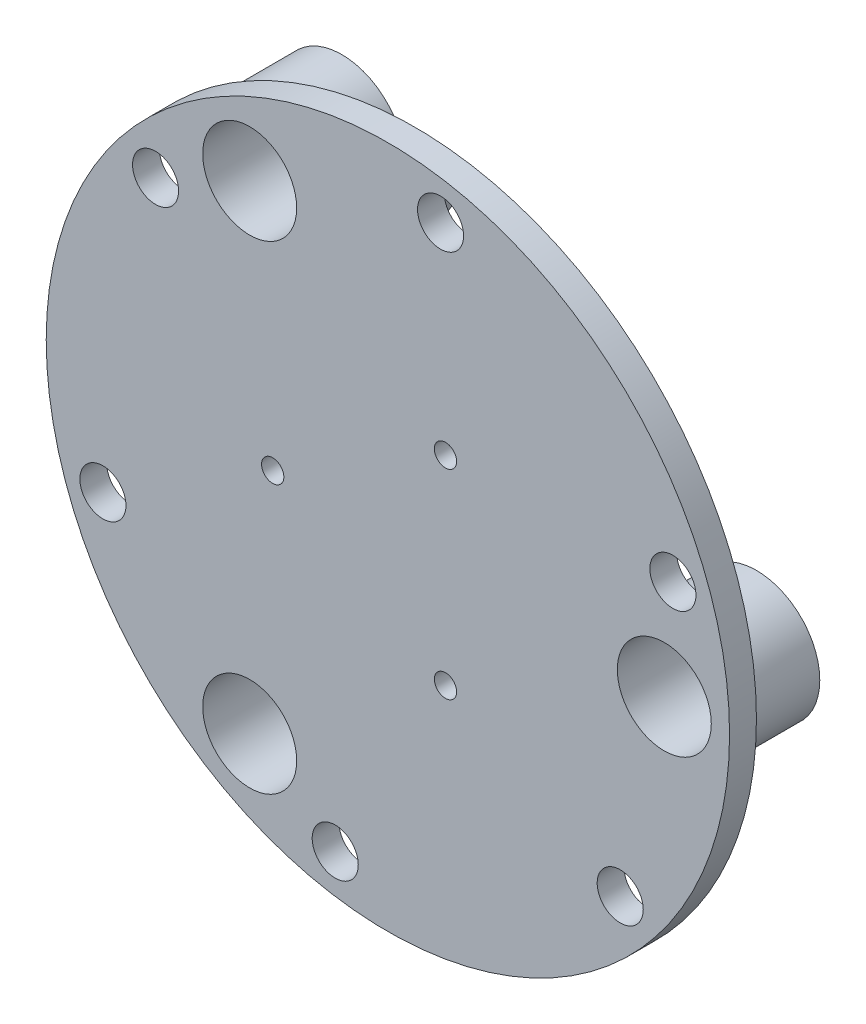
from build123d import *

# Parameters (mm, degrees)
F_01_START                                = 33.5
S01_JOINING_CENTRE_OF_FLOATING_Y_R        = 9
F_01_JOINING_CENTRE_OF_FLOATING_Y_DEPTH   = 3.5
F_02_START                                = 33.5
F_02_FLOATING_SPOKE_1_DEPTH               = 3.5
F_03_START                                = 33.5
F_03_FLOATING_SPOKE_2_DEPTH               = 3.5
F_04_START                                = 33.5
F_04_FLOATING_SPOKE_3_DEPTH               = 3.5
F_05_START                                = 33.5
F_05_MOVING_TENDON_TIE_WEB_1_DEPTH        = 3.5
F_06_START                                = 29.8
S06_TENDON_ANCHOR_BASE_1_R                = 4.2
F_06_TENDON_ANCHOR_BASE_1_DEPTH           = 3.7
F_07_START                                = 28
S07_TENDON_MOUTH_1_R                      = 3.15
F_07_TENDON_MOUTH_1_DEPTH                 = 1.8
F_08_START                                = 33.5
F_08_MOVING_TENDON_TIE_WEB_2_DEPTH        = 3.5
F_09_START                                = 29.8
S09_TENDON_ANCHOR_BASE_2_R                = 4.2
F_09_TENDON_ANCHOR_BASE_2_DEPTH           = 3.7
F_10_START                                = 28
S10_TENDON_MOUTH_2_R                      = 3.15
F_10_TENDON_MOUTH_2_DEPTH                 = 1.8
F_11_START                                = 33.5
F_11_MOVING_TENDON_TIE_WEB_3_DEPTH        = 3.5
F_12_START                                = 29.8
S12_TENDON_ANCHOR_BASE_3_R                = 4.2
F_12_TENDON_ANCHOR_BASE_3_DEPTH           = 3.7
F_13_START                                = 28
S13_TENDON_MOUTH_3_R                      = 3.15
F_13_TENDON_MOUTH_3_DEPTH                 = 1.8
F_14_START                                = 33.5
S14_JOINED_DRIVE_HOOP_R                   = 44.5
F_14_JOINED_DRIVE_HOOP_DEPTH              = 3.5
F_15_START                                = 25
S15_SLIDING_GUIDE_BARREL_1_R              = 8.25
F_15_SLIDING_GUIDE_BARREL_1_DEPTH         = 12
F_16_START                                = 25
S16_SLIDING_GUIDE_BARREL_2_R              = 8.25
F_16_SLIDING_GUIDE_BARREL_2_DEPTH         = 12
F_17_START                                = 25
S17_SLIDING_GUIDE_BARREL_3_R              = 8.25
F_17_SLIDING_GUIDE_BARREL_3_DEPTH         = 12
F_18_START                                = 24
S18_GUIDE_BUSHING_SEATS_R                 = 6.12
F_18_GUIDE_BUSHING_SEATS_DEPTH            = 14
F_19_START                                = 27.8
S19_THROUGH_TENDON_TIE_EYES_R             = 1.45
F_19_THROUGH_TENDON_TIE_EYES_DEPTH        = 10
F_20_START                                = -7.2
F_20_INTEGRAL_B1_FORK_CHEEK_L_DEPTH       = 3.6
F_21_START                                = 3.6
F_21_INTEGRAL_B1_FORK_CHEEK_R_DEPTH       = 3.6
F_22_START                                = -7.5
S22_B1_PIVOT_THROUGH_BOTH_CHEEKS_R        = 1.65
F_22_B1_PIVOT_THROUGH_BOTH_CHEEKS_DEPTH   = 15
F_23_START                                = -7.3
S23_B1_RECESSED_PIVOT_SCREW_HEAD_R        = 2.7
F_23_B1_RECESSED_PIVOT_SCREW_HEAD_DEPTH   = 1.5
F_24_START                                = -7.2
F_24_INTEGRAL_B2_FORK_CHEEK_L_DEPTH       = 3.6
F_25_START                                = 3.6
F_25_INTEGRAL_B2_FORK_CHEEK_R_DEPTH       = 3.6
F_26_START                                = 7.5
S26_B2_PIVOT_THROUGH_BOTH_CHEEKS_R        = 2.6
F_26_B2_PIVOT_THROUGH_BOTH_CHEEKS_DEPTH   = 15
F_27_START                                = -7.3
S27_B2_RECESSED_PIVOT_SCREW_HEAD_R        = 2.7
F_27_B2_RECESSED_PIVOT_SCREW_HEAD_DEPTH   = 1.5
F_28_START                                = -7.2
F_28_INTEGRAL_B3_FORK_CHEEK_L_DEPTH       = 3.6
F_29_START                                = 3.6
F_29_INTEGRAL_B3_FORK_CHEEK_R_DEPTH       = 3.6
F_30_START                                = 7.5
S30_B3_PIVOT_THROUGH_BOTH_CHEEKS_R        = 2.6
F_30_B3_PIVOT_THROUGH_BOTH_CHEEKS_DEPTH   = 15
F_31_START                                = -7.3
S31_B3_RECESSED_PIVOT_SCREW_HEAD_R        = 2.7
F_31_B3_RECESSED_PIVOT_SCREW_HEAD_DEPTH   = 1.5
CUT_EXTRUDE1_DEPTH                        = 74.425869509
CUT_EXTRUDE1_DEPTH_BACK                   = 16
SKETCH1_R                                 = 2.6
FORK_INNER_FACES_8_40_MM_LUG_CLEARANCE_BY = 0.6
FORK_INNER_FACES_8_40_MM_LUG_CLEAR_2_BY   = 0.6
FORK_INNER_FACES_8_40_MM_LUG_CLEAR_3_BY   = 0.6
FORK_INNER_FACES_8_40_MM_LUG_CLEAR_4_BY   = 0.6
FORK_INNER_FACES_8_40_MM_LUG_CLEAR_5_BY   = 0.6
FORK_INNER_FACES_8_40_MM_LUG_CLEAR_6_BY   = 0.6
SIX_START                                 = 37.1
SIX_6_MM_HOLES_ON_79_MM_PITCH_CIRCLE_R    = 3
SIX_LIGHTENING_HOLES_AT_60_DEGREES_DEPTH  = 3.7
CENTRAL_START                             = 30.55
CENTRAL_SIX_SIDED_RIB_JUNCTION_DEPTH      = 3


with BuildPart() as part:
    # S01 - Joining centre of floating Y → 01 - Joining centre of floating Y (new body)
    with BuildSketch(Plane.XY.offset(F_01_START)):
        Circle(S01_JOINING_CENTRE_OF_FLOATING_Y_R)
    extrude(amount=F_01_JOINING_CENTRE_OF_FLOATING_Y_DEPTH)

    # S02 - Floating spoke 1 → 02 - Floating spoke 1 (add)
    with BuildSketch(Plane.XY.offset(F_02_START)):
        with BuildLine():
            Line((4.65, -8.054036255), (-21.330762114, -23.054036255))
            ThreePointArc((-21.330762114, -23.054036255), (-34.034798369, -19.65), (-30.630762114, -6.945963745))
            Line((-30.630762114, -6.945963745), (-4.65, 8.054036255))
            ThreePointArc((-4.65, 8.054036255), (8.054036255, 4.65), (4.65, -8.054036255))
        make_face()
    extrude(amount=F_02_FLOATING_SPOKE_1_DEPTH)

    # S03 - Floating spoke 2 → 03 - Floating spoke 2 (add)
    with BuildSketch(Plane.XY.offset(F_03_START)):
        with BuildLine():
            Line((4.65, 8.054036255), (30.630762114, -6.945963745))
            ThreePointArc((30.630762114, -6.945963745), (34.034798369, -19.65), (21.330762114, -23.054036255))
            Line((21.330762114, -23.054036255), (-4.65, -8.054036255))
            ThreePointArc((-4.65, -8.054036255), (-8.054036255, 4.65), (4.65, 8.054036255))
        make_face()
    extrude(amount=F_03_FLOATING_SPOKE_2_DEPTH)

    # S04 - Floating spoke 3 → 04 - Floating spoke 3 (add)
    with BuildSketch(Plane.XY.offset(F_04_START)):
        with BuildLine():
            Line((-9.3, 0), (-9.3, 30))
            ThreePointArc((-9.3, 30), (0, 39.3), (9.3, 30))
            Line((9.3, 30), (9.3, 0))
            ThreePointArc((9.3, 0), (0, -9.3), (-9.3, 0))
        make_face()
    extrude(amount=F_04_FLOATING_SPOKE_3_DEPTH)

    # S05 - Moving tendon tie web 1 → 05 - Moving tendon tie web 1 (add)
    with BuildSketch(Plane.XY.offset(F_05_START)):
        with BuildLine():
            Line((25.299707774, -21.263079513), (6.818945661, -19.25346057))
            ThreePointArc((6.818945661, -19.25346057), (1.236920487, -12.309326717), (8.181054339, -6.727301544))
            Line((8.181054339, -6.727301544), (26.661816453, -8.736920487))
            ThreePointArc((26.661816453, -8.736920487), (32.243841627, -15.681054339), (25.299707774, -21.263079513))
        make_face()
    extrude(amount=F_05_MOVING_TENDON_TIE_WEB_1_DEPTH)

    # S06 - Tendon anchor base 1 → 06 - Tendon anchor base 1 (add)
    with BuildSketch(Plane.XY.offset(F_06_START)):
        with Locations((7.5, -12.990381057)):
            Circle(S06_TENDON_ANCHOR_BASE_1_R)
    extrude(amount=F_06_TENDON_ANCHOR_BASE_1_DEPTH)

    # S07 - Tendon mouth 1 → 07 - Tendon mouth 1 (add)
    with BuildSketch(Plane.XY.offset(F_07_START)):
        with Locations((7.5, -12.990381057)):
            Circle(S07_TENDON_MOUTH_1_R)
    extrude(amount=F_07_TENDON_MOUTH_1_DEPTH)

    # S08 - Moving tendon tie web 2 → 08 - Moving tendon tie web 2 (add)
    with BuildSketch(Plane.XY.offset(F_08_START)):
        with BuildLine():
            Line((5.764513134, 32.541729397), (13.264513134, 15.532110454))
            ThreePointArc((13.264513134, 15.532110454), (10.041729397, 7.225867923), (1.735486866, 10.448651659))
            Line((1.735486866, 10.448651659), (-5.764513134, 27.458270603))
            ThreePointArc((-5.764513134, 27.458270603), (-2.541729397, 35.764513134), (5.764513134, 32.541729397))
        make_face()
    extrude(amount=F_08_MOVING_TENDON_TIE_WEB_2_DEPTH)

    # S09 - Tendon anchor base 2 → 09 - Tendon anchor base 2 (add)
    with BuildSketch(Plane.XY.offset(F_09_START)):
        with Locations((7.5, 12.990381057)):
            Circle(S09_TENDON_ANCHOR_BASE_2_R)
    extrude(amount=F_09_TENDON_ANCHOR_BASE_2_DEPTH)

    # S10 - Tendon mouth 2 → 10 - Tendon mouth 2 (add)
    with BuildSketch(Plane.XY.offset(F_10_START)):
        with Locations((7.5, 12.990381057)):
            Circle(S10_TENDON_MOUTH_2_R)
    extrude(amount=F_10_TENDON_MOUTH_2_DEPTH)

    # S11 - Moving tendon tie web 3 → 11 - Moving tendon tie web 3 (add)
    with BuildSketch(Plane.XY.offset(F_11_START)):
        with BuildLine():
            Line((-31.064220908, -11.278649884), (-20.083458795, 3.721350116))
            ThreePointArc((-20.083458795, 3.721350116), (-11.278649884, 5.083458795), (-9.916541205, -3.721350116))
            Line((-9.916541205, -3.721350116), (-20.897303319, -18.721350116))
            ThreePointArc((-20.897303319, -18.721350116), (-29.702112229, -20.083458795), (-31.064220908, -11.278649884))
        make_face()
    extrude(amount=F_11_MOVING_TENDON_TIE_WEB_3_DEPTH)

    # S12 - Tendon anchor base 3 → 12 - Tendon anchor base 3 (add)
    with BuildSketch(Plane.XY.offset(F_12_START)):
        with Locations((-15, 0)):
            Circle(S12_TENDON_ANCHOR_BASE_3_R)
    extrude(amount=F_12_TENDON_ANCHOR_BASE_3_DEPTH)

    # S13 - Tendon mouth 3 → 13 - Tendon mouth 3 (add)
    with BuildSketch(Plane.XY.offset(F_13_START)):
        with Locations((-15, 0)):
            Circle(S13_TENDON_MOUTH_3_R)
    extrude(amount=F_13_TENDON_MOUTH_3_DEPTH)

    # S14 - Joined drive hoop → 14 - Joined drive hoop (add)
    with BuildSketch(Plane.XY.offset(F_14_START)):
        Circle(S14_JOINED_DRIVE_HOOP_R)
    extrude(amount=F_14_JOINED_DRIVE_HOOP_DEPTH)

    # S15 - Sliding guide barrel 1 → 15 - Sliding guide barrel 1 (add)
    with BuildSketch(Plane.XY.offset(F_15_START)):
        with Locations((36, 0)):
            Circle(S15_SLIDING_GUIDE_BARREL_1_R)
    extrude(amount=F_15_SLIDING_GUIDE_BARREL_1_DEPTH)

    # S16 - Sliding guide barrel 2 → 16 - Sliding guide barrel 2 (add)
    with BuildSketch(Plane.XY.offset(F_16_START)):
        with Locations((-18, 31.176914536)):
            Circle(S16_SLIDING_GUIDE_BARREL_2_R)
    extrude(amount=F_16_SLIDING_GUIDE_BARREL_2_DEPTH)

    # S17 - Sliding guide barrel 3 → 17 - Sliding guide barrel 3 (add)
    with BuildSketch(Plane.XY.offset(F_17_START)):
        with Locations((-18, -31.176914536)):
            Circle(S17_SLIDING_GUIDE_BARREL_3_R)
    extrude(amount=F_17_SLIDING_GUIDE_BARREL_3_DEPTH)

    # S18 - Guide bushing seats → 18 - Guide bushing seats (cut)
    with BuildSketch(Plane.XY.offset(F_18_START)):
        with Locations((36, 0)):
            Circle(S18_GUIDE_BUSHING_SEATS_R)
        with Locations((-18, 31.176914536)):
            Circle(S18_GUIDE_BUSHING_SEATS_R)
        with Locations((-18, -31.176914536)):
            Circle(S18_GUIDE_BUSHING_SEATS_R)
    extrude(amount=F_18_GUIDE_BUSHING_SEATS_DEPTH, mode=Mode.SUBTRACT)

    # S19 - Through tendon tie eyes → 19 - Through tendon tie eyes (cut)
    with BuildSketch(Plane.XY.offset(F_19_START)):
        with Locations((7.5, -12.990381057)):
            Circle(S19_THROUGH_TENDON_TIE_EYES_R)
        with Locations((7.5, 12.990381057)):
            Circle(S19_THROUGH_TENDON_TIE_EYES_R)
        with Locations((-15, 0)):
            Circle(S19_THROUGH_TENDON_TIE_EYES_R)
    extrude(amount=F_19_THROUGH_TENDON_TIE_EYES_DEPTH, mode=Mode.SUBTRACT)

    # S20 - Integral B1 fork cheek L → 20 - Integral B1 fork cheek L (add)
    with BuildSketch(Plane(origin=(2.009618943, -7.5, 0), x_dir=(0.9659258262890683, 0.2588190451025208, 0), z_dir=(-0.2588190451025208, 0.9659258262890684, 0)).offset(F_20_START)):
        with BuildLine():
            Line((-35.077774789, -34.5), (-22.877774789, -34.5))
            Line((-22.877774789, -34.5), (-24.027774789, -28))
            ThreePointArc((-24.027774789, -28), (-28.977774789, -23.05), (-33.927774789, -28))
            Line((-33.927774789, -28), (-35.077774789, -34.5))
        make_face()
    extrude(amount=F_20_INTEGRAL_B1_FORK_CHEEK_L_DEPTH)

    # S21 - Integral B1 fork cheek R → 21 - Integral B1 fork cheek R (add)
    with BuildSketch(Plane(origin=(2.009618943, -7.5, 0), x_dir=(0.9659258262890683, 0.2588190451025208, 0), z_dir=(-0.2588190451025208, 0.9659258262890684, 0)).offset(F_21_START)):
        with BuildLine():
            Line((-35.077774789, -34.5), (-22.877774789, -34.5))
            Line((-22.877774789, -34.5), (-24.027774789, -28))
            ThreePointArc((-24.027774789, -28), (-28.977774789, -23.05), (-33.927774789, -28))
            Line((-33.927774789, -28), (-35.077774789, -34.5))
        make_face()
    extrude(amount=F_21_INTEGRAL_B1_FORK_CHEEK_R_DEPTH)

    # S22 - B1 pivot through both cheeks → 22 - B1 pivot through both cheeks (cut)
    with BuildSketch(Plane(origin=(2.009618943, -7.5, 0), x_dir=(0.9659258262890683, 0.2588190451025208, 0), z_dir=(-0.2588190451025208, 0.9659258262890684, 0)).offset(F_22_START)):
        with Locations(Location((-28.977774789, -28, 0), (0, 0, 180))):
            Circle(S22_B1_PIVOT_THROUGH_BOTH_CHEEKS_R)
    extrude(amount=F_22_B1_PIVOT_THROUGH_BOTH_CHEEKS_DEPTH, mode=Mode.SUBTRACT)

    # S23 - B1 recessed pivot screw head → 23 - B1 recessed pivot screw head (cut)
    with BuildSketch(Plane(origin=(2.009618943, -7.5, 0), x_dir=(0.9659258262890683, 0.2588190451025208, 0), z_dir=(-0.2588190451025208, 0.9659258262890684, 0)).offset(F_23_START)):
        with Locations(Location((-28.977774789, -28, 0), (0, 0, 180))):
            Circle(S23_B1_RECESSED_PIVOT_SCREW_HEAD_R)
    extrude(amount=F_23_B1_RECESSED_PIVOT_SCREW_HEAD_DEPTH, mode=Mode.SUBTRACT)

    # S24 - Integral B2 fork cheek L → 24 - Integral B2 fork cheek L (add)
    with BuildSketch(Plane(origin=(5.490381057, 5.490381057, 0), x_dir=(0, 0, 1), z_dir=(-0.7071067811865476, -0.7071067811865475, 0)).offset(F_24_START)):
        with BuildLine():
            Line((34.5, -35.077774789), (34.5, -22.877774789))
            Line((34.5, -22.877774789), (28, -24.027774789))
            ThreePointArc((28, -24.027774789), (23.05, -28.977774789), (28, -33.927774789))
            Line((28, -33.927774789), (34.5, -35.077774789))
        make_face()
    extrude(amount=F_24_INTEGRAL_B2_FORK_CHEEK_L_DEPTH)

    # S25 - Integral B2 fork cheek R → 25 - Integral B2 fork cheek R (add)
    with BuildSketch(Plane(origin=(5.490381057, 5.490381057, 0), x_dir=(0, 0, 1), z_dir=(-0.7071067811865476, -0.7071067811865475, 0)).offset(F_25_START)):
        with BuildLine():
            Line((34.5, -35.077774789), (34.5, -22.877774789))
            Line((34.5, -22.877774789), (28, -24.027774789))
            ThreePointArc((28, -24.027774789), (23.05, -28.977774789), (28, -33.927774789))
            Line((28, -33.927774789), (34.5, -35.077774789))
        make_face()
    extrude(amount=F_25_INTEGRAL_B2_FORK_CHEEK_R_DEPTH)

    # S26 - B2 pivot through both cheeks → 26 - B2 pivot through both cheeks (cut)
    with BuildSketch(Plane(origin=(5.490381057, 5.490381057, 0), x_dir=(0, 0, 1), z_dir=(-0.7071067811865476, -0.7071067811865475, 0)).offset(F_26_START)):
        with Locations(Location((28, -28.977774789, 0), (0, 0, 270))):
            Circle(S26_B2_PIVOT_THROUGH_BOTH_CHEEKS_R)
    extrude(amount=-F_26_B2_PIVOT_THROUGH_BOTH_CHEEKS_DEPTH, mode=Mode.SUBTRACT)

    # S27 - B2 recessed pivot screw head → 27 - B2 recessed pivot screw head (cut)
    with BuildSketch(Plane(origin=(5.490381057, 5.490381057, 0), x_dir=(0, 0, 1), z_dir=(-0.7071067811865476, -0.7071067811865475, 0)).offset(F_27_START)):
        with Locations(Location((28, -28.977774789, 0), (0, 0, 270))):
            Circle(S27_B2_RECESSED_PIVOT_SCREW_HEAD_R)
    extrude(amount=F_27_B2_RECESSED_PIVOT_SCREW_HEAD_DEPTH, mode=Mode.SUBTRACT)

    # S28 - Integral B3 fork cheek L → 28 - Integral B3 fork cheek L (add)
    with BuildSketch(Plane(origin=(-7.5, 2.009618943, 0), x_dir=(0, 0, -1), z_dir=(0.9659258262890683, -0.25881904510252113, 0)).offset(F_28_START)):
        with BuildLine():
            Line((-34.5, 35.077774789), (-34.5, 22.877774789))
            Line((-34.5, 22.877774789), (-28, 24.027774789))
            ThreePointArc((-28, 24.027774789), (-23.05, 28.977774789), (-28, 33.927774789))
            Line((-28, 33.927774789), (-34.5, 35.077774789))
        make_face()
    extrude(amount=F_28_INTEGRAL_B3_FORK_CHEEK_L_DEPTH)

    # S29 - Integral B3 fork cheek R → 29 - Integral B3 fork cheek R (add)
    with BuildSketch(Plane(origin=(-7.5, 2.009618943, 0), x_dir=(0, 0, -1), z_dir=(0.9659258262890683, -0.25881904510252113, 0)).offset(F_29_START)):
        with BuildLine():
            Line((-34.5, 35.077774789), (-34.5, 22.877774789))
            Line((-34.5, 22.877774789), (-28, 24.027774789))
            ThreePointArc((-28, 24.027774789), (-23.05, 28.977774789), (-28, 33.927774789))
            Line((-28, 33.927774789), (-34.5, 35.077774789))
        make_face()
    extrude(amount=F_29_INTEGRAL_B3_FORK_CHEEK_R_DEPTH)

    # S30 - B3 pivot through both cheeks → 30 - B3 pivot through both cheeks (cut)
    with BuildSketch(Plane(origin=(-7.5, 2.009618943, 0), x_dir=(0, 0, -1), z_dir=(0.9659258262890683, -0.25881904510252113, 0)).offset(F_30_START)):
        with Locations(Location((-28, 28.977774789, 0), (0, 0, 90))):
            Circle(S30_B3_PIVOT_THROUGH_BOTH_CHEEKS_R)
    extrude(amount=-F_30_B3_PIVOT_THROUGH_BOTH_CHEEKS_DEPTH, mode=Mode.SUBTRACT)

    # S31 - B3 recessed pivot screw head → 31 - B3 recessed pivot screw head (cut)
    with BuildSketch(Plane(origin=(-7.5, 2.009618943, 0), x_dir=(0, 0, -1), z_dir=(0.9659258262890683, -0.25881904510252113, 0)).offset(F_31_START)):
        with Locations(Location((-28, 28.977774789, 0), (0, 0, 90))):
            Circle(S31_B3_RECESSED_PIVOT_SCREW_HEAD_R)
    extrude(amount=F_31_B3_RECESSED_PIVOT_SCREW_HEAD_DEPTH, mode=Mode.SUBTRACT)

    # Sketch1 → Cut-Extrude1 (cut, two sides: drawn at the far end of the back side and taken through both)
    with BuildSketch(Plane(origin=(0.146121818, -0.545334051, 0), x_dir=(0.9659258262890683, 0.25881904510252085, 0), z_dir=(-0.2588190451025208, 0.9659258262890682, 0)).offset(-CUT_EXTRUDE1_DEPTH_BACK)):
        with Locations(Location((-28.977774789, -28, 0), (0, 0, 180))):
            Circle(SKETCH1_R)
    extrude(amount=CUT_EXTRUDE1_DEPTH + CUT_EXTRUDE1_DEPTH_BACK, mode=Mode.SUBTRACT)

    # Fork inner faces - 8.40 mm lug clearance: a face moved inward by 0.6
    extrude(part.faces().sort_by_distance((-25.049013551, -18.477332975, 30.8875))[0], amount=FORK_INNER_FACES_8_40_MM_LUG_CLEARANCE_BY, dir=(0.258819045, -0.965925826, 0), mode=Mode.SUBTRACT)

    # Fork inner faces - 8.40 mm lug clear 2: a face moved inward by 0.6
    extrude(part.faces().sort_by_distance((-26.912510676, -11.522667025, 30.8875))[0], amount=FORK_INNER_FACES_8_40_MM_LUG_CLEAR_2_BY, dir=(-0.258819045, 0.965925826, 0), mode=Mode.SUBTRACT)

    # Fork inner faces - 8.40 mm lug clear 3: a face moved inward by 0.6
    extrude(part.faces().sort_by_distance((30.620470455, -14.548539517, 28.275))[0], amount=FORK_INNER_FACES_8_40_MM_LUG_CLEAR_3_BY, dir=(0.707106781, 0.707106781, 0), mode=Mode.SUBTRACT)

    # Fork inner faces - 8.40 mm lug clear 4: a face moved inward by 0.6
    extrude(part.faces().sort_by_distance((25.52930163, -19.639708341, 28.275))[0], amount=FORK_INNER_FACES_8_40_MM_LUG_CLEAR_4_BY, dir=(-0.707106781, -0.707106781, 0), mode=Mode.SUBTRACT)

    # Fork inner faces - 8.40 mm lug clear 5: a face moved inward by 0.6
    extrude(part.faces().sort_by_distance((-4.243835531, 28.071122077, 28.275))[0], amount=FORK_INNER_FACES_8_40_MM_LUG_CLEAR_5_BY, dir=(-0.965925826, 0.258819045, 0), mode=Mode.SUBTRACT)

    # Fork inner faces - 8.40 mm lug clear 6: a face moved inward by 0.6
    extrude(part.faces().sort_by_distance((2.710830418, 26.207624952, 28.275))[0], amount=FORK_INNER_FACES_8_40_MM_LUG_CLEAR_6_BY, dir=(0.965925826, -0.258819045, 0), mode=Mode.SUBTRACT)

    # Six 6 mm holes on 79 mm pitch circle → Six lightening holes at 60 degrees (cut)
    with BuildSketch(Plane.XY.offset(SIX_START)):
        with Locations((37.117858521, 13.509795661)):
            Circle(SIX_6_MM_HOLES_ON_79_MM_PITCH_CIRCLE_R)
        with Locations((6.859103018, 38.899906244)):
            Circle(SIX_6_MM_HOLES_ON_79_MM_PITCH_CIRCLE_R)
        with Locations((-30.258755503, 25.390110583)):
            Circle(SIX_6_MM_HOLES_ON_79_MM_PITCH_CIRCLE_R)
        with Locations((-37.117858521, -13.509795661)):
            Circle(SIX_6_MM_HOLES_ON_79_MM_PITCH_CIRCLE_R)
        with Locations((-6.859103018, -38.899906244)):
            Circle(SIX_6_MM_HOLES_ON_79_MM_PITCH_CIRCLE_R)
        with Locations((30.258755503, -25.390110583)):
            Circle(SIX_6_MM_HOLES_ON_79_MM_PITCH_CIRCLE_R)
    extrude(amount=-SIX_LIGHTENING_HOLES_AT_60_DEGREES_DEPTH, mode=Mode.SUBTRACT)

    # Central hub - 11 mm across flats → Central six-sided rib junction (add)
    with BuildSketch(Plane.XY.offset(CENTRAL_START)):
        Polygon((5.5, 3.175426481), (0, 6.350852961), (-5.5, 3.175426481), (-5.5, -3.175426481), (0, -6.350852961), (5.5, -3.175426481), align=None)
    extrude(amount=CENTRAL_SIX_SIDED_RIB_JUNCTION_DEPTH)

    # Guide 1 radial trapezoidal rib - root → Guide 1 radial trapezoidal rib section 0
    with BuildSketch(Plane(origin=(4.85, -2.25, 33.55), x_dir=(0, 0.8011814241315997, -0.5984215283781675), z_dir=(1, 0, 0))):
        with BuildLine():
            Line((0, 0), (3.605316409, 2.692896878))
            Line((3.605316409, 2.692896878), (4.96305674, 0))
            Line((4.96305674, 0), (2.196883547, -2.066120782))
            Line((2.196883547, -2.066120782), (0, 0))
        make_face()
    # Guide 1 radial trapezoidal rib - tip → Guide 1 radial trapezoidal rib section 1
    with BuildSketch(Plane(origin=(29.15, -2.7, 33.55), x_dir=(0, 0.5044526883330976, -0.8634393350047882), z_dir=(1, 0, 0))):
        with BuildLine():
            Line((0, 0), (2.724044517, 4.662572409))
            Line((2.724044517, 4.662572409), (8.222928597, 0))
            Line((8.222928597, 0), (6.761954477, -2.500655765))
            Line((6.761954477, -2.500655765), (0, 0))
        make_face()
    loft()

    # Tendon 1 radial trapezoidal rib - root → Tendon 1 radial trapezoidal rib section 0
    with BuildSketch(Plane(origin=(4.027146997, 3.275223208, 33.55), x_dir=(-0.6325712569152563, 0.36521518546164355, -0.6829871691568372), z_dir=(0.5000000000000003, 0.8660254037844385, 0))):
        with BuildLine():
            Line((0, 0), (2.702592372, 2.527052526))
            Line((2.702592372, 2.527052526), (4.348544357, 0))
            Line((4.348544357, 0), (2.410991801, -1.811703877))
            Line((2.410991801, -1.811703877), (0, 0))
        make_face()
    # Tendon 1 radial trapezoidal rib - tip → Tendon 1 radial trapezoidal rib section 1
    with BuildSketch(Plane(origin=(7.770448267, 9.658811196, 33.55), x_dir=(-0.6024162615456616, 0.34780519076759553, -0.7184192349182097), z_dir=(0.4999999999999997, 0.8660254037844388, 0))):
        with BuildLine():
            Line((0, 0), (2.64331945, 2.729993093))
            Line((2.64331945, 2.729993093), (4.621257114, 0))
            Line((4.621257114, 0), (2.792366056, -1.888859841))
            Line((2.792366056, -1.888859841), (0, 0))
        make_face()
    loft()

    # Guide 2 radial trapezoidal rib - root → Guide 2 radial trapezoidal rib section 0
    with BuildSketch(Plane(origin=(-0.476442841, 5.325223208, 33.55), x_dir=(-0.6938434663381602, -0.40059071206579977, -0.5984215283781676), z_dir=(-0.49999999999999983, 0.8660254037844387, 0))):
        with BuildLine():
            Line((0, 0), (3.605316409, 2.692896878))
            Line((3.605316409, 2.692896878), (4.96305674, 0))
            Line((4.96305674, 0), (2.196883547, -2.066120782))
            Line((2.196883547, -2.066120782), (0, 0))
        make_face()
    # Guide 2 radial trapezoidal rib - tip → Guide 2 radial trapezoidal rib section 1
    with BuildSketch(Plane(origin=(-12.23673141, 26.59464052, 33.55), x_dir=(-0.4368688431038167, -0.25222634416654865, -0.8634393350047881), z_dir=(-0.4999999999999996, 0.8660254037844389, 0))):
        with BuildLine():
            Line((0, 0), (2.724044517, 4.662572409))
            Line((2.724044517, 4.662572409), (8.222928597, 0))
            Line((8.222928597, 0), (6.761954477, -2.500655765))
            Line((6.761954477, -2.500655765), (0, 0))
        make_face()
    loft()

    # Tendon 2 radial trapezoidal rib - root → Tendon 2 radial trapezoidal rib section 0
    with BuildSketch(Plane(origin=(-4.85, 1.85, 33.55), x_dir=(0, -0.7304303709232866, -0.6829871691568371), z_dir=(-1, 0, 0))):
        with BuildLine():
            Line((0, 0), (2.702592372, 2.527052526))
            Line((2.702592372, 2.527052526), (4.348544357, 0))
            Line((4.348544357, 0), (2.410991801, -1.811703877))
            Line((2.410991801, -1.811703877), (0, 0))
        make_face()
    # Tendon 2 radial trapezoidal rib - tip → Tendon 2 radial trapezoidal rib section 1
    with BuildSketch(Plane(origin=(-12.25, 1.9, 33.55), x_dir=(0, -0.6956103815351913, -0.7184192349182096), z_dir=(-1, 0, 0))):
        with BuildLine():
            Line((0, 0), (2.64331945, 2.729993093))
            Line((2.64331945, 2.729993093), (4.621257114, 0))
            Line((4.621257114, 0), (2.792366056, -1.888859841))
            Line((2.792366056, -1.888859841), (0, 0))
        make_face()
    loft()

    # Guide 3 radial trapezoidal rib - root → Guide 3 radial trapezoidal rib section 0
    with BuildSketch(Plane(origin=(-4.373557159, -3.075223208, 33.55), x_dir=(0.69384346633816, -0.4005907120658002, -0.5984215283781676), z_dir=(-0.5000000000000004, -0.8660254037844385, 0))):
        with BuildLine():
            Line((0, 0), (3.605316409, 2.692896878))
            Line((3.605316409, 2.692896878), (4.96305674, 0))
            Line((4.96305674, 0), (2.196883547, -2.066120782))
            Line((2.196883547, -2.066120782), (0, 0))
        make_face()
    # Guide 3 radial trapezoidal rib - tip → Guide 3 radial trapezoidal rib section 1
    with BuildSketch(Plane(origin=(-16.91326859, -23.89464052, 33.55), x_dir=(0.4368688431038163, -0.25222634416654915, -0.8634393350047881), z_dir=(-0.5000000000000009, -0.8660254037844382, 0))):
        with BuildLine():
            Line((0, 0), (2.724044517, 4.662572409))
            Line((2.724044517, 4.662572409), (8.222928597, 0))
            Line((8.222928597, 0), (6.761954477, -2.500655765))
            Line((6.761954477, -2.500655765), (0, 0))
        make_face()
    loft()

    # Tendon 3 radial trapezoidal rib - root → Tendon 3 radial trapezoidal rib section 0
    with BuildSketch(Plane(origin=(0.822853003, -5.125223208, 33.55), x_dir=(0.6325712569152565, 0.36521518546164344, -0.6829871691568372), z_dir=(0.5000000000000003, -0.8660254037844385, 0))):
        with BuildLine():
            Line((0, 0), (2.702592372, 2.527052526))
            Line((2.702592372, 2.527052526), (4.348544357, 0))
            Line((4.348544357, 0), (2.410991801, -1.811703877))
            Line((2.410991801, -1.811703877), (0, 0))
        make_face()
    # Tendon 3 radial trapezoidal rib - tip → Tendon 3 radial trapezoidal rib section 1
    with BuildSketch(Plane(origin=(4.479551733, -11.558811196, 33.55), x_dir=(0.6024162615456616, 0.34780519076759553, -0.7184192349182097), z_dir=(0.4999999999999997, -0.8660254037844388, 0))):
        with BuildLine():
            Line((0, 0), (2.64331945, 2.729993093))
            Line((2.64331945, 2.729993093), (4.621257114, 0))
            Line((4.621257114, 0), (2.792366056, -1.888859841))
            Line((2.792366056, -1.888859841), (0, 0))
        make_face()
    loft()


solid = part.part
